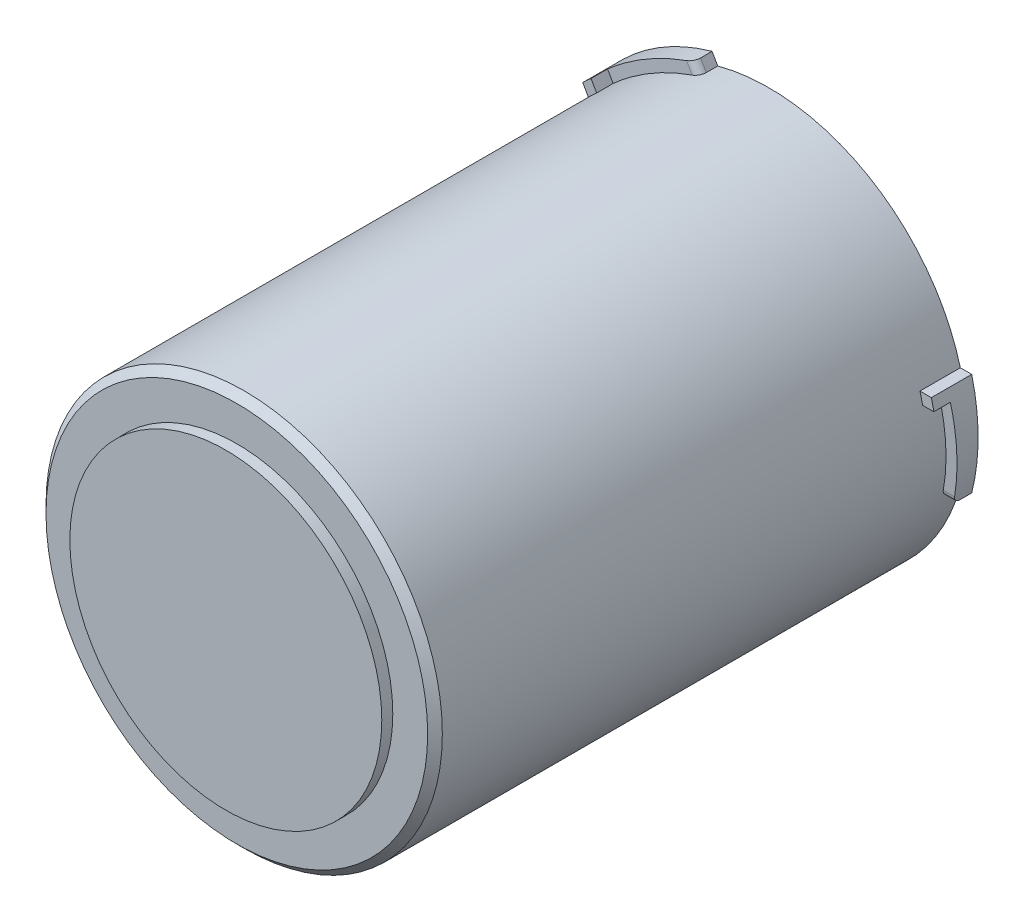
from build123d import *

# Parameters (mm, degrees)
EXTRUDE_1_DEPTH                  = 10
FILLET_1_R                       = 2
PATTERN_CIRCULAR_2_COUNT         = 3
FILLET_1_OF_PATTERN_CIRCULAR_2_R = 2
CUT_EXTRUDE_START                = -15
SKETCH_3_R                       = 51
CUT_EXTRUDE_1_DEPTH              = 15
SKETCH_4_R                       = 62.618720145
SKETCH_4_R_2                     = 57
CUT_EXTRUDE_2_DEPTH              = 15
CHAMFER_1_SIZE                   = 2
FILLET_2_R                       = 5
SKETCH_5_R                       = 42.5
EXTRUDE_2_DEPTH                  = 3


with BuildPart() as part:
    # Эскиз1 → Повернуть1 (revolve)
    with BuildSketch(Plane(origin=(0, 0, 0), x_dir=(1, 0, 0), z_dir=(0, 1, 0))):
        Polygon((0, 0), (-54, 0), (-54, 145), (-51, 145), (-51, 3), (0, 3), align=None)
    revolve(axis=Axis((0, 0, -3), (0, 0, 1)))

    # Эскиз2 → Бобышка-Вытянуть1 (add)
    with BuildSketch(Plane(origin=(57, 0, 0), x_dir=(0, 0, -1), z_dir=(1, 0, 0))):
        Polygon((145, 14), (145, -14), (140, -14), (138.5, 11), (134, 11), (134, 14), align=None)
    extrude_1 = extrude(amount=-EXTRUDE_1_DEPTH)

    # Скругление1
    fillet_1_edges = [part.edges().sort_by_distance(p)[0] for p in [
        (54.576809621, -14, -140),
    ]]
    fillet(fillet_1_edges, radius=FILLET_1_R)

    # Круговой массив2: Бобышка-Вытянуть1 ×3 about axis
    pattern_circular_2_axis = Axis((0, 0, -145), (0, 0, -1))
    for i in range(1, PATTERN_CIRCULAR_2_COUNT):
        add(extrude_1.rotate(pattern_circular_2_axis, i * 360 / PATTERN_CIRCULAR_2_COUNT))

    # Скругление1 of Круговой массив2
    fillet_1_of_pattern_circular_2_edges = [part.edges().sort_by_distance(p)[0] for p in [
        (-39.412760463, -40.264903589, -140),
        (-15.164049157, 54.264903589, -140),
    ]]
    fillet(fillet_1_of_pattern_circular_2_edges, radius=FILLET_1_OF_PATTERN_CIRCULAR_2_R)

    # Эскиз3 → Вырез-Вытянуть1 (cut)
    with BuildSketch(Plane(origin=(0, 0, -145), x_dir=(-1, 0, 0), z_dir=(0, 0, -1)).offset(CUT_EXTRUDE_START)):
        Circle(SKETCH_3_R)
    extrude(amount=CUT_EXTRUDE_1_DEPTH, mode=Mode.SUBTRACT)

    # Эскиз4 → Вырез-Вытянуть2 (cut)
    with BuildSketch(Plane(origin=(0, 0, -145), x_dir=(-1, 0, 0), z_dir=(0, 0, -1))):
        Circle(SKETCH_4_R)
        Circle(SKETCH_4_R_2, mode=Mode.SUBTRACT)
    extrude(amount=-CUT_EXTRUDE_2_DEPTH, mode=Mode.SUBTRACT)

    # Фаска1
    chamfer_1_edges = [part.edges().sort_by_distance(p)[0] for p in [
        (54, 0, 0),
    ]]
    chamfer(chamfer_1_edges, length=CHAMFER_1_SIZE)

    # Скругление2
    fillet_2_edges = [part.edges().sort_by_distance(p)[0] for p in [
        (51, 0, -3),
    ]]
    fillet(fillet_2_edges, radius=FILLET_2_R)

    # Эскиз5 → Бобышка-Вытянуть2 (add)
    with BuildSketch(Plane.XY):
        Circle(SKETCH_5_R)
    extrude(amount=EXTRUDE_2_DEPTH)


solid = part.part
